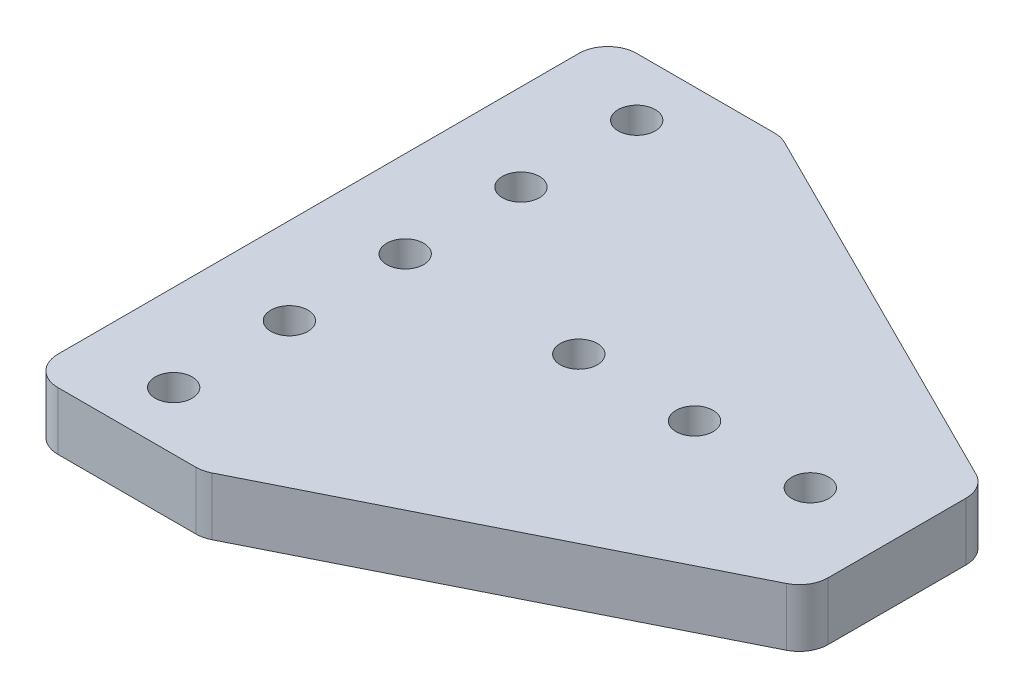
from build123d import *

# Parameters (mm, degrees)
SKETCH1_R           = 4.064
BOSS_EXTRUDE1_DEPTH = 12.7
FILLET1_R           = 6.35


with BuildPart() as part:
    # Sketch1 → Boss-Extrude1 (new body)
    with BuildSketch(Plane(origin=(0, 0, 0), x_dir=(1, 0, 0), z_dir=(0, 1, 0))):
        Polygon((0, 0), (0, 127), (38.1, 127), (127, 82.55), (127, 44.45), (38.1, 0), align=None)
        with Locations(Location((19.05, 12.7, 0), (0, 0, 270))):
            Circle(SKETCH1_R, mode=Mode.SUBTRACT)
        with Locations(Location((19.05, 38.1, 0), (0, 0, 270))):
            Circle(SKETCH1_R, mode=Mode.SUBTRACT)
        with Locations(Location((19.05, 63.5, 0), (0, 0, 270))):
            Circle(SKETCH1_R, mode=Mode.SUBTRACT)
        with Locations(Location((19.05, 88.9, 0), (0, 0, 270))):
            Circle(SKETCH1_R, mode=Mode.SUBTRACT)
        with Locations(Location((19.05, 114.3, 0), (0, 0, 270))):
            Circle(SKETCH1_R, mode=Mode.SUBTRACT)
        with Locations(Location((107.95, 63.5, 0), (0, 0, 270))):
            Circle(SKETCH1_R, mode=Mode.SUBTRACT)
        with Locations(Location((82.55, 63.5, 0), (0, 0, 270))):
            Circle(SKETCH1_R, mode=Mode.SUBTRACT)
        with Locations(Location((57.15, 63.5, 0), (0, 0, 270))):
            Circle(SKETCH1_R, mode=Mode.SUBTRACT)
    extrude(amount=BOSS_EXTRUDE1_DEPTH)

    # Fillet1
    fillet1_edges = [part.edges().sort_by_distance(p)[0] for p in [
        (0, 6.35, 0),
        (0, 6.35, -127),
        (38.1, 6.35, -127),
        (127, 6.35, -82.55),
        (127, 6.35, -44.45),
        (38.1, 6.35, 0),
    ]]
    fillet(fillet1_edges, radius=FILLET1_R)


solid = part.part
